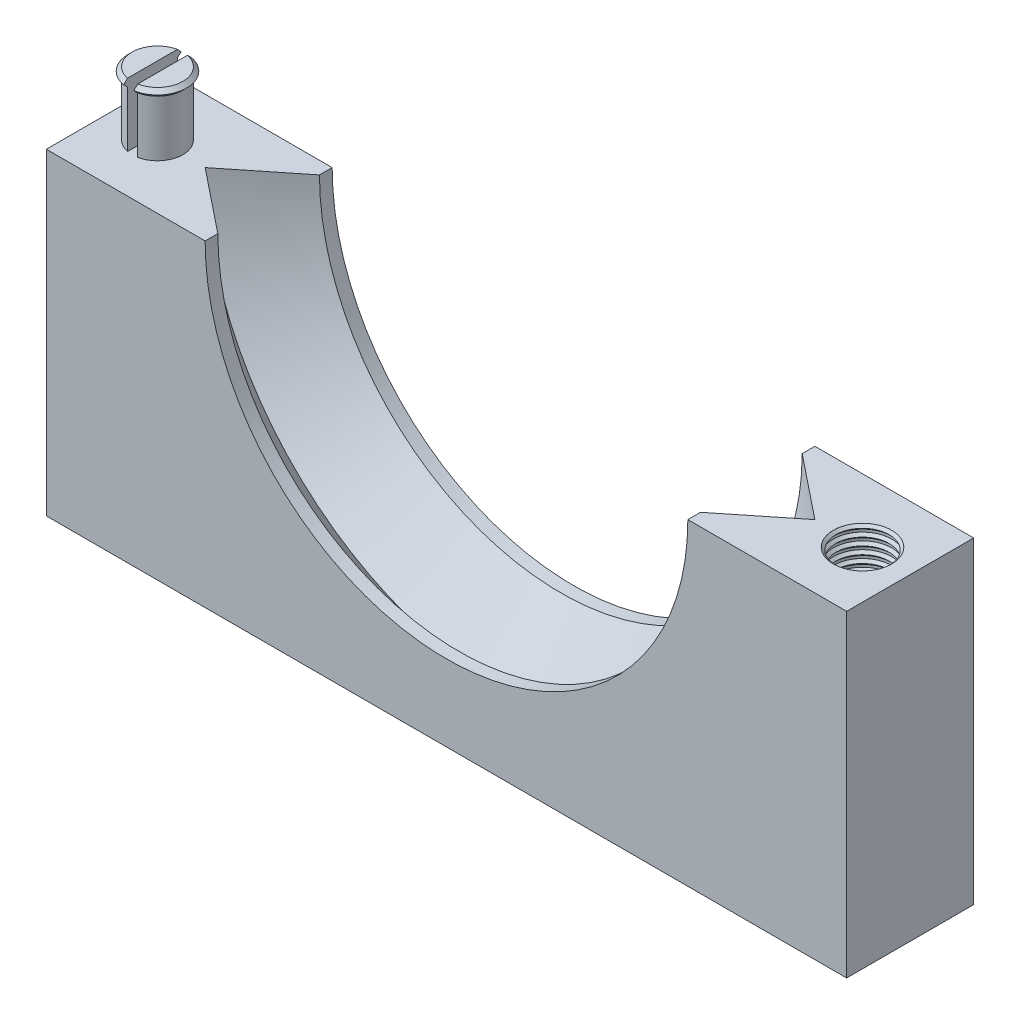
from build123d import *

# Parameters (mm, degrees)
BOSS_EXTRUDE1_DEPTH = 12.7
SKETCH6_R           = 2.921
CUT_EXTRUDE2_DEPTH  = 9.525
CUT_EXTRUDE3_REACH  = 58.686
SKETCH16_W          = 1.016
SKETCH16_H          = 11.1836739


with BuildPart() as part:
    # Sketch1 → Boss-Extrude1 (new body)
    with BuildSketch(Plane.XY):
        with BuildLine():
            Line((-40.005, 0), (40.005, 0))
            Line((40.005, 0), (40.005, 31.75))
            Line((40.005, 31.75), (24.13, 31.75))
            ThreePointArc((24.13, 31.75), (0, 7.62), (-24.13, 31.75))
            Line((-24.13, 31.75), (-40.005, 31.75))
            Line((-40.005, 31.75), (-40.005, 0))
        make_face()
    extrude(amount=BOSS_EXTRUDE1_DEPTH)

    # Sketch2 → Cut-Revolve1 (revolve, cut)
    with BuildSketch(Plane(origin=(0, 31.75, 0), x_dir=(1, 0, 0), z_dir=(0, 1, 0))):
        Polygon((24.13, -11.43), (30.48, -6.35), (24.13, -1.27), align=None)
    revolve(axis=Axis((0, 31.75, 0), (0, 0, 1)), mode=Mode.SUBTRACT)

    # Sketch6 → Cut-Extrude2 (cut)
    with BuildSketch(Plane(origin=(0, 31.75, 0), x_dir=(1, 0, 0), z_dir=(0, 1, 0))):
        with Locations(Location((35.2425, -6.35, 0), (0, 0, 180))):
            Circle(SKETCH6_R)
    extrude(amount=-CUT_EXTRUDE2_DEPTH, mode=Mode.SUBTRACT)

    # Sketch15 → Revolve2 (revolve)
    with BuildSketch(Plane.XY.offset(6.35), mode=Mode.PRIVATE) as revolve2_sk:
        Polygon((-37.7825, 31.75), (-37.7825, 37.338), (-38.1635, 37.719), (-37.7825, 38.1), (-35.2425, 38.1), (-35.2425, 31.75), align=None)
    revolve(revolve2_sk.sketch.rotate(Axis((-35.2425, 38.1, 6.35), (0, -1, 0)), 270), axis=Axis((-35.2425, 38.1, 6.35), (0, -1, 0)))

    # Cut-Extrude3: up to this face of the body (flat: up to its plane)
    cut_extrude3_end = Plane(part.part.faces().sort_by_distance((-32.0675, 31.75, 0.203299195))[0])
    # Sketch16 → Cut-Extrude3 (cut, up to the picked face)
    with BuildSketch(Plane(origin=(0, 38.1, 0), x_dir=(1, 0, 0), z_dir=(0, 1, 0)), mode=Mode.PRIVATE) as cut_extrude3_sk1:
        with Locations((-35.2425, -6.35)):
            Rectangle(SKETCH16_W, SKETCH16_H)
    cut_extrude3_tool1 = split(extrude(cut_extrude3_sk1.sketch, amount=-CUT_EXTRUDE3_REACH, mode=Mode.PRIVATE), bisect_by=cut_extrude3_end, keep=Keep.BOTH, mode=Mode.PRIVATE)
    add(cut_extrude3_tool1.solids().sort_by(Axis((-35.2425, 38.1, 6.35), (0, -1, 0)))[0], mode=Mode.SUBTRACT)


with BuildPart() as body_2:
    # Sketch12 → Revolve1 (revolve)
    with BuildSketch(Plane.XY.offset(6.35), mode=Mode.PRIVATE) as revolve1_sk:
        Polygon((32.3215, 30.48), (32.5755, 30.734), (32.3215, 30.988), align=None)
        Polygon((32.3215, 31.242), (32.5755, 31.496), (32.3215, 31.75), align=None)
        Polygon((32.3215, 29.718), (32.5755, 29.972), (32.3215, 30.226), align=None)
        Polygon((32.3215, 28.956), (32.5755, 29.21), (32.3215, 29.464), align=None)
        Polygon((32.3215, 28.194), (32.5755, 28.448), (32.3215, 28.702), align=None)
        Polygon((32.3215, 27.432), (32.5755, 27.686), (32.3215, 27.94), align=None)
        Polygon((32.3215, 26.67), (32.5755, 26.924), (32.3215, 27.178), align=None)
        Polygon((32.3215, 25.908), (32.5755, 26.162), (32.3215, 26.416), align=None)
        Polygon((32.3215, 25.146), (32.5755, 25.4), (32.3215, 25.654), align=None)
        Polygon((32.3215, 24.384), (32.5755, 24.638), (32.3215, 24.892), align=None)
        Polygon((32.3215, 23.622), (32.5755, 23.876), (32.3215, 24.13), align=None)
        Polygon((32.3215, 22.86), (32.5755, 23.114), (32.3215, 23.368), align=None)
        Polygon((32.3215, 22.098), (32.5755, 22.352), (32.3215, 22.606), align=None)
        Polygon((32.3215, 21.336), (32.5755, 21.59), (32.3215, 21.844), align=None)
        Polygon((32.3215, 20.574), (32.5755, 20.828), (32.3215, 21.082), align=None)
        Polygon((32.3215, 19.812), (32.5755, 20.066), (32.3215, 20.32), align=None)
        Polygon((32.3215, 19.05), (32.5755, 19.304), (32.3215, 19.558), align=None)
        Polygon((32.3215, 18.288), (32.5755, 18.542), (32.3215, 18.796), align=None)
        Polygon((32.3215, 17.526), (32.5755, 17.78), (32.3215, 18.034), align=None)
        Polygon((32.3215, 16.764), (32.5755, 17.018), (32.3215, 17.272), align=None)
    revolve(revolve1_sk.sketch.rotate(Axis((35.2425, 31.75, 6.35), (0, -1, 0)), 270), axis=Axis((35.2425, 31.75, 6.35), (0, -1, 0)))


solid = Compound([part.part, body_2.part])
